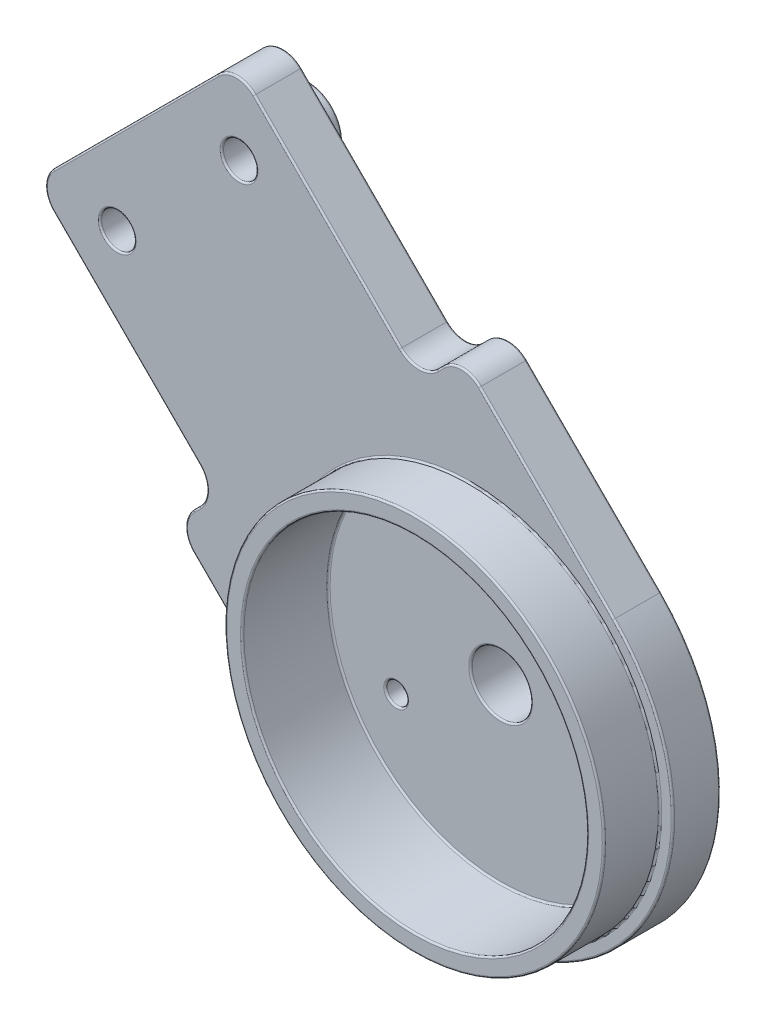
from build123d import *
from build123d.topology import SkipClean

# Parameters (mm, degrees)
SKETCH5_R               = 10
SKETCH5_R_2             = 1
BOSS_EXTRUDE1_DEPTH     = 2.75
SKETCH7_R               = 10
BOSS_EXTRUDE2_DEPTH     = 1
SKETCH8_R               = 11
SKETCH8_R_2             = 10
BOSS_EXTRUDE3_DEPTH     = 5
FILLET1_R               = 1.5
BOSS_EXTRUDE4_START     = 1.25
SKETCH9_R               = 2
SKETCH9_R_2             = 1
BOSS_EXTRUDE4_DEPTH     = 1.25
CUT_EXTRUDE1_DEPTH      = 115.595231102
CUT_EXTRUDE1_DEPTH_BACK = 115.595231102
SKETCH10_R              = 1.75
BOSS_EXTRUDE6_START     = 4.25
SKETCH12_R              = 3.45
SKETCH12_R_2            = 1.75
BOSS_EXTRUDE6_DEPTH     = 4.25
CUT_EXTRUDE2_DEPTH      = 115.595231102
CUT_EXTRUDE2_DEPTH_BACK = 115.595231102
SKETCH14_R              = 0.625
FILLET2_R               = 0.1


with BuildPart() as part:
    # Sketch5 → Boss-Extrude1 (new body)
    with BuildSketch(Plane.XY):
        with BuildLine():
            Line((74.720932573, 13.611805538), (86.388194462, 25.279067427))
            Line((86.388194462, 25.279067427), (96.99479618, 14.67246571))
            Line((96.99479618, 14.67246571), (99.469669914, 17.147339444))
            Line((99.469669914, 17.147339444), (108.308504679, 8.308504679))
            ThreePointArc((108.308504679, 8.308504679), (108.308504679, -8.308504679), (91.691495321, -8.308504679))
            Line((91.691495321, -8.308504679), (82.852660556, 0.530330086))
            Line((82.852660556, 0.530330086), (85.32753429, 3.00520382))
            Line((85.32753429, 3.00520382), (74.720932573, 13.611805538))
        make_face()
        with Locations((100, 0)):
            Circle(SKETCH5_R, mode=Mode.SUBTRACT)
        with Locations((86.564971157, 20.506096654)):
            Circle(SKETCH5_R_2, mode=Mode.SUBTRACT)
        with Locations((79.493903346, 13.435028843)):
            Circle(SKETCH5_R_2, mode=Mode.SUBTRACT)
    extrude(amount=BOSS_EXTRUDE1_DEPTH)

    # Sketch7 → Boss-Extrude2 (add)
    with BuildSketch(Plane(origin=(0, 0, 0), x_dir=(-1, 0, 0), z_dir=(0, 0, -1))):
        with Locations((-100, 0)):
            Circle(SKETCH7_R)
    extrude(amount=-BOSS_EXTRUDE2_DEPTH)

    # Sketch8 → Boss-Extrude3 (add)
    with BuildSketch(Plane.XY.offset(1)):
        with Locations((100, 0)):
            Circle(SKETCH8_R)
        with Locations(Location((100, 0, 0), (0, 0, 180))):
            Circle(SKETCH8_R_2, mode=Mode.SUBTRACT)
    extrude(amount=BOSS_EXTRUDE3_DEPTH)

    # Fillet1
    fillet1_edges = [part.edges().sort_by_distance(p)[0] for p in [
        (74.720932573, 13.611805538, 1.375),
        (86.388194462, 25.279067427, 1.375),
        (96.99479618, 14.67246571, 1.375),
        (99.469669914, 17.147339444, 1.375),
        (82.852660556, 0.530330086, 1.375),
        (85.32753429, 3.00520382, 1.375),
    ]]
    fillet(fillet1_edges, radius=FILLET1_R)

    # Sketch9 → Boss-Extrude4 (add)
    # profile 1 of 2: a face of its own
    with SkipClean():  # the faces are left unmerged after this step: merging them gives an invalid solid
        with BuildSketch(Plane(origin=(0, 0, 0), x_dir=(-1, 0, 0), z_dir=(0, 0, -1)).offset(BOSS_EXTRUDE4_START)):
            with Locations(Location((-86.564971157, 20.506096654, 0), (0, 0, 180))):
                Circle(SKETCH9_R)
            with Locations((-86.564971157, 20.506096654)):
                Circle(SKETCH9_R_2, mode=Mode.SUBTRACT)
        # profile 2 of 2: a face of its own
        with BuildSketch(Plane(origin=(0, 0, 0), x_dir=(-1, 0, 0), z_dir=(0, 0, -1)).offset(BOSS_EXTRUDE4_START)):
            with Locations(Location((-79.493903346, 13.435028843, 0), (0, 0, 180))):
                Circle(SKETCH9_R)
            with Locations((-79.493903346, 13.435028843)):
                Circle(SKETCH9_R_2, mode=Mode.SUBTRACT)
        extrude(amount=-BOSS_EXTRUDE4_DEPTH)

    # Sketch10 → Cut-Extrude1 (cut, two sides: drawn at the far end of the back side and taken through both)
    with SkipClean():  # the faces are left unmerged after this step: merging them gives an invalid solid
        with BuildSketch(Plane(origin=(0, 0, 0), x_dir=(-1, 0, 0), z_dir=(0, 0, -1)).offset(-CUT_EXTRUDE1_DEPTH_BACK)):
            with Locations((-100, 0)):
                Circle(SKETCH10_R)
        extrude(amount=CUT_EXTRUDE1_DEPTH + CUT_EXTRUDE1_DEPTH_BACK, mode=Mode.SUBTRACT)

    # Sketch12 → Boss-Extrude6 (add)
    with SkipClean():  # the faces are left unmerged after this step: merging them gives an invalid solid
        with BuildSketch(Plane(origin=(0, 0, 0), x_dir=(-1, 0, 0), z_dir=(0, 0, -1)).offset(BOSS_EXTRUDE6_START)):
            with Locations(Location((-100, 0, 0), (0, 0, 180))):
                Circle(SKETCH12_R)
            with Locations((-100, 0)):
                Circle(SKETCH12_R_2, mode=Mode.SUBTRACT)
        extrude(amount=-BOSS_EXTRUDE6_DEPTH)

    # Sketch14 → Cut-Extrude2 (cut, two sides: drawn at the far end of the back side and taken through both)
    with SkipClean():  # the faces are left unmerged after this step: merging them gives an invalid solid
        with BuildSketch(Plane(origin=(0, 0, 0), x_dir=(-1, 0, 0), z_dir=(0, 0, -1)).offset(-CUT_EXTRUDE2_DEPTH_BACK)):
            with Locations((-100, 7)):
                Circle(SKETCH14_R)
            with Locations((-93.937822174, -3.5)):
                Circle(SKETCH14_R)
            with Locations((-106.062177826, -3.5)):
                Circle(SKETCH14_R)
        extrude(amount=CUT_EXTRUDE2_DEPTH + CUT_EXTRUDE2_DEPTH_BACK, mode=Mode.SUBTRACT)

    # Fillet2
    fillet2_edges = [part.edges().sort_by_distance(p)[0] for p in [
        (77.493903346, 13.435028843, 0),
        (77.493903346, 13.435028843, -1.25),
        (108.308504679, -8.308504679, 0),
        (80.493903346, 13.435028843, -1.25),
        (101.75, 0, 1),
        (96.55, 0, 0),
        (96.55, 0, -4.25),
        (101.75, 0, -4.25),
        (100.625, 7, 1),
        (100.625, 7, 0),
        (94.562822174, -3.5, 1),
        (94.562822174, -3.5, 0),
        (106.687177826, -3.5, 1),
        (106.687177826, -3.5, 0),
        (108.308504679, -8.308504679, 2.75),
        (104.419417382, 12.197591975, 2.75),
        (85.564971157, 20.506096654, 2.75),
        (78.493903346, 13.435028843, 2.75),
        (90, 0, 1),
        (89, 0, 2.75),
        (89, 0, 6),
        (110, 0, 6),
        (80.024233431, 8.308504679, 0),
        (80.024233431, 8.308504679, 2.75),
        (80.554563517, 19.445436483, 0),
        (91.691495321, 19.975766569, 0),
        (98.232233047, 15.909902577, 0),
        (87.802408025, -4.419417382, 0),
        (84.090097423, 1.767766953, 0),
        (86.388194462, 24.657747084, 0),
        (83.4739809, 0.530330086, 0),
        (99.469669914, 16.5260191, 0),
        (75.342252916, 13.611805538, 0),
        (80.554563517, 19.445436483, 2.75),
        (84.090097423, 1.767766953, 2.75),
        (87.802408025, -4.419417382, 2.75),
        (98.232233047, 15.909902577, 2.75),
        (91.691495321, 19.975766569, 2.75),
        (86.388194462, 24.657747084, 2.75),
        (83.4739809, 0.530330086, 2.75),
        (99.469669914, 16.5260191, 2.75),
        (75.342252916, 13.611805538, 2.75),
        (96.99479618, 15.293786053, 0),
        (96.99479618, 15.293786053, 2.75),
        (84.706213947, 3.00520382, 0),
        (84.706213947, 3.00520382, 2.75),
        (84.564971157, 20.506096654, 0),
        (84.564971157, 20.506096654, -1.25),
        (87.564971157, 20.506096654, -1.25),
        (104.419417382, 12.197591975, 0),
    ]]
    fillet(fillet2_edges, radius=FILLET2_R)


solid = part.part
